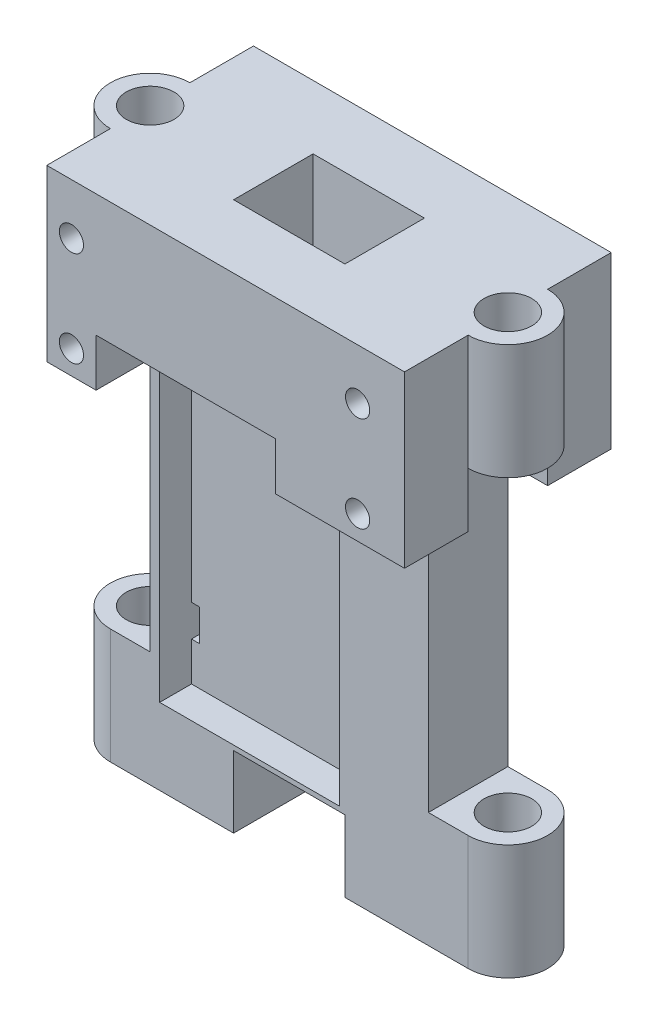
from build123d import *

# Parameters (mm, degrees)
SKETCH2_R                    = 3.81
BOSS_EXTRUDE1_DEPTH          = 43.815
SKETCH7_W                    = 28.702
SKETCH7_H                    = 55.88
CUT_EXTRUDE3_DEPTH           = 5.08
SKETCH11_W                   = 57.15
SKETCH11_H                   = 27.178
BOSS_EXTRUDE2_DEPTH          = 10.16
SKETCH14_W                   = 28.702
SKETCH14_H                   = 7.62
CUT_EXTRUDE4_DEPTH           = 10.16
SKETCH16_W                   = 17.78
SKETCH16_H                   = 12.7
CUT_EXTRUDE5_DEPTH           = 12.7
SKETCH17_W                   = 17.78
SKETCH17_H                   = 12.7
CUT_EXTRUDE6_DEPTH           = 11.43
CUT_EXTRUDE7_DEPTH           = 25.4
SKETCH21_W                   = 1.27
SKETCH21_H                   = 5.08
CUT_EXTRUDE8_DEPTH           = 59.784677
SKETCH23_R                   = 1.9304
CUT_EXTRUDE9_DEPTH           = 11.27
CUT_EXTRUDE9_DRAFT           = -8
CUT_EXTRUDE9_PROFILE_2_DEPTH = 11.27
CUT_EXTRUDE9_PROFILE_2_DRAFT = -8
CUT_EXTRUDE9_PROFILE_3_DEPTH = 11.27
CUT_EXTRUDE9_PROFILE_3_DRAFT = -8
CUT_EXTRUDE9_PROFILE_4_DEPTH = 11.27
CUT_EXTRUDE9_PROFILE_4_DRAFT = -8
MIRROR8_COPY_1_SKETCH_R      = 1.9304
MIRROR8_COPY_1_DEPTH         = 11.27
MIRROR8_COPY_1_DRAFT         = -8
MIRROR8_COPY_2_SKETCH_R      = 1.9304
MIRROR8_COPY_2_DEPTH         = 11.27
MIRROR8_COPY_2_DRAFT         = -8
MIRROR8_COPY_3_SKETCH_R      = 1.9304
MIRROR8_COPY_3_DEPTH         = 11.27
MIRROR8_COPY_3_DRAFT         = -8
MIRROR8_COPY_4_SKETCH_R      = 1.9304
MIRROR8_COPY_4_DEPTH         = 11.27
MIRROR8_COPY_4_DRAFT         = -8
MIRROR8_COPY_5_SKETCH_R      = 1.9304
MIRROR8_COPY_5_DEPTH         = 11.27
MIRROR8_COPY_5_DRAFT         = -8
MIRROR8_COPY_6_SKETCH_R      = 1.9304
MIRROR8_COPY_6_DEPTH         = 11.27
MIRROR8_COPY_6_DRAFT         = -8
MIRROR8_COPY_7_SKETCH_R      = 1.9304
MIRROR8_COPY_7_DEPTH         = 11.27
MIRROR8_COPY_7_DRAFT         = -8


with BuildPart() as part:
    # Sketch2 → Boss-Extrude1 (new, symmetric)
    with BuildSketch(Plane(origin=(0, 0, 0), x_dir=(1, 0, 0), z_dir=(0, 1, 0))):
        with BuildLine():
            Line((-28.575, 6.35), (28.575, 6.35))
            ThreePointArc((28.575, 6.35), (34.925, 0), (28.575, -6.35))
            Line((28.575, -6.35), (-28.575, -6.35))
            ThreePointArc((-28.575, -6.35), (-34.925, 0), (-28.575, 6.35))
        make_face()
        with Locations(Location((28.575, 0, 0), (0, 0, 270))):
            Circle(SKETCH2_R, mode=Mode.SUBTRACT)
        with Locations(Location((-28.575, 0, 0), (0, 0, 270))):
            Circle(SKETCH2_R, mode=Mode.SUBTRACT)
    extrude(amount=BOSS_EXTRUDE1_DEPTH, both=True)

    # Sketch7 → Cut-Extrude3 (cut)
    with BuildSketch(Plane.XY.offset(6.35)):
        with Locations((-6.35, -3.683)):
            Rectangle(SKETCH7_W, SKETCH7_H)
    cut_extrude3 = extrude(amount=-CUT_EXTRUDE3_DEPTH, mode=Mode.SUBTRACT)

    # Mirror1: Cut-Extrude3 across plane
    add(cut_extrude3.mirror(Plane.XY), mode=Mode.SUBTRACT)

    # Sketch11 → Boss-Extrude2 (add)
    with BuildSketch(Plane(origin=(0, 0, -6.35), x_dir=(-1, 0, 0), z_dir=(0, 0, -1))):
        with Locations((0, 30.226)):
            Rectangle(SKETCH11_W, SKETCH11_H)
    boss_extrude2 = extrude(amount=BOSS_EXTRUDE2_DEPTH)

    # Mirror3: Boss-Extrude2 across plane
    add(boss_extrude2.mirror(Plane.XY))

    # Sketch14 → Cut-Extrude4 (cut)
    with BuildSketch(Plane(origin=(0, 0, -16.51), x_dir=(-1, 0, 0), z_dir=(0, 0, -1))):
        with Locations((6.35, 20.447)):
            Rectangle(SKETCH14_W, SKETCH14_H)
    cut_extrude4 = extrude(amount=-CUT_EXTRUDE4_DEPTH, mode=Mode.SUBTRACT)

    # Mirror4: Cut-Extrude4 across plane
    add(cut_extrude4.mirror(Plane.XY), mode=Mode.SUBTRACT)

    # Sketch16 → Cut-Extrude5 (cut)
    with BuildSketch(Plane(origin=(0, 43.815, 0), x_dir=(1, 0, 0), z_dir=(0, 1, 0))):
        Rectangle(SKETCH16_W, SKETCH16_H)
    extrude(amount=-CUT_EXTRUDE5_DEPTH, mode=Mode.SUBTRACT)

    # Sketch17 → Cut-Extrude6 (cut)
    with BuildSketch(Plane.XZ.offset(43.815)):
        Rectangle(SKETCH17_W, SKETCH17_H)
    extrude(amount=-CUT_EXTRUDE6_DEPTH, mode=Mode.SUBTRACT)

    # Sketch19 → Cut-Extrude7 (cut, symmetric)
    with BuildSketch(Plane(origin=(0, 0, 0), x_dir=(1, 0, 0), z_dir=(0, 1, 0))):
        with BuildLine():
            Line((22.225, 6.35), (22.225, -6.35))
            Line((22.225, -6.35), (28.575, -6.35))
            ThreePointArc((28.575, -6.35), (34.925, 0), (28.575, 6.35))
            Line((28.575, 6.35), (22.225, 6.35))
        make_face()
    cut_extrude7 = extrude(amount=CUT_EXTRUDE7_DEPTH, both=True, mode=Mode.SUBTRACT)

    # Mirror5: Cut-Extrude7 across plane
    add(cut_extrude7.mirror(Plane(origin=(0, 0, 0), x_dir=(0, 0, 1), z_dir=(1, 0, 0))), mode=Mode.SUBTRACT)

    # Sketch21 → Cut-Extrude8 (cut, through all)
    with BuildSketch(Plane.XY.offset(1.27)):
        with Locations((7.366, 12.7)):
            Rectangle(SKETCH21_W, SKETCH21_H)
        with Locations((-20.066, 12.7)):
            Rectangle(SKETCH21_W, SKETCH21_H)
        with Locations((7.366, -22.86)):
            Rectangle(SKETCH21_W, SKETCH21_H)
        with Locations((-20.066, -22.86)):
            Rectangle(SKETCH21_W, SKETCH21_H)
    extrude(amount=-CUT_EXTRUDE8_DEPTH, mode=Mode.SUBTRACT)


with BuildPart() as cut_extrude9_tool:
    # Sketch23 → Cut-Extrude9 (with draft: the straight prism first)
    with BuildSketch(Plane.XY.offset(16.51)):
        with Locations((-24.638, 20.447)):
            Circle(SKETCH23_R)
    extrude(amount=-CUT_EXTRUDE9_DEPTH)
    # Cut-Extrude9: the draft: its side faces are tilted about the plane it starts from
    cut_extrude9_sides = [cut_extrude9_tool.faces().sort_by_distance(p)[0] for p in [
        (-26.5684, 20.447, 10.875),
    ]]
    draft(cut_extrude9_sides, Plane.XY.offset(16.51), CUT_EXTRUDE9_DRAFT)


with BuildPart() as part_1:
    add(part.part)

    # Cut-Extrude9: cut by cut_extrude9_tool
    add(cut_extrude9_tool.part, mode=Mode.SUBTRACT)


with BuildPart() as cut_extrude9_profile_2_tool:
    # Sketch23 → Cut-Extrude9 profile 2 (with draft: the straight prism first)
    with BuildSketch(Plane.XY.offset(16.51)):
        with Locations((-24.638, 35.687)):
            Circle(SKETCH23_R)
    extrude(amount=-CUT_EXTRUDE9_PROFILE_2_DEPTH)
    # Cut-Extrude9 profile 2: the draft: its side faces are tilted about the plane it starts from
    cut_extrude9_profile_2_sides = [cut_extrude9_profile_2_tool.faces().sort_by_distance(p)[0] for p in [
        (-26.5684, 35.687, 10.875),
    ]]
    draft(cut_extrude9_profile_2_sides, Plane.XY.offset(16.51), CUT_EXTRUDE9_PROFILE_2_DRAFT)


with BuildPart() as part_2:
    add(part_1.part)

    # Cut-Extrude9 profile 2: cut by cut_extrude9_profile_2_tool
    add(cut_extrude9_profile_2_tool.part, mode=Mode.SUBTRACT)


with BuildPart() as cut_extrude9_profile_3_tool:
    # Sketch23 → Cut-Extrude9 profile 3 (with draft: the straight prism first)
    with BuildSketch(Plane.XY.offset(16.51)):
        with Locations((21.082, 20.447)):
            Circle(SKETCH23_R)
    extrude(amount=-CUT_EXTRUDE9_PROFILE_3_DEPTH)
    # Cut-Extrude9 profile 3: the draft: its side faces are tilted about the plane it starts from
    cut_extrude9_profile_3_sides = [cut_extrude9_profile_3_tool.faces().sort_by_distance(p)[0] for p in [
        (19.1516, 20.447, 10.875),
    ]]
    draft(cut_extrude9_profile_3_sides, Plane.XY.offset(16.51), CUT_EXTRUDE9_PROFILE_3_DRAFT)


with BuildPart() as part_3:
    add(part_2.part)

    # Cut-Extrude9 profile 3: cut by cut_extrude9_profile_3_tool
    add(cut_extrude9_profile_3_tool.part, mode=Mode.SUBTRACT)


with BuildPart() as cut_extrude9_profile_4_tool:
    # Sketch23 → Cut-Extrude9 profile 4 (with draft: the straight prism first)
    with BuildSketch(Plane.XY.offset(16.51)):
        with Locations((21.082, 35.687)):
            Circle(SKETCH23_R)
    extrude(amount=-CUT_EXTRUDE9_PROFILE_4_DEPTH)
    # Cut-Extrude9 profile 4: the draft: its side faces are tilted about the plane it starts from
    cut_extrude9_profile_4_sides = [cut_extrude9_profile_4_tool.faces().sort_by_distance(p)[0] for p in [
        (19.1516, 35.687, 10.875),
    ]]
    draft(cut_extrude9_profile_4_sides, Plane.XY.offset(16.51), CUT_EXTRUDE9_PROFILE_4_DRAFT)


with BuildPart() as part_4:
    add(part_3.part)

    # Cut-Extrude9 profile 4: cut by cut_extrude9_profile_4_tool
    add(cut_extrude9_profile_4_tool.part, mode=Mode.SUBTRACT)


with BuildPart() as mirror8_copy_1_tool:
    # Mirror8 copy 1 sketch → Mirror8 copy 1 (with draft: the straight prism first)
    with BuildSketch(Plane(origin=(0, 0, -16.51), x_dir=(1, 0, 0), z_dir=(0, 0, -1))):
        with Locations((-24.638, -20.447)):
            Circle(MIRROR8_COPY_1_SKETCH_R)
    extrude(amount=-MIRROR8_COPY_1_DEPTH)
    # Mirror8 copy 1: the draft: its side faces are tilted about the plane it starts from
    mirror8_copy_1_sides = [mirror8_copy_1_tool.faces().sort_by_distance(p)[0] for p in [
        (-26.5684, 20.447, -10.875),
    ]]
    draft(mirror8_copy_1_sides, Plane(origin=(0, 0, -16.51), x_dir=(1, 0, 0), z_dir=(0, 0, -1)), MIRROR8_COPY_1_DRAFT)


with BuildPart() as part_5:
    add(part_4.part)

    # Mirror8 copy 1: cut by mirror8_copy_1_tool
    add(mirror8_copy_1_tool.part, mode=Mode.SUBTRACT)


with BuildPart() as mirror8_copy_2_tool:
    # Mirror8 copy 2 sketch → Mirror8 copy 2 (with draft: the straight prism first)
    with BuildSketch(Plane(origin=(0, 0, -16.51), x_dir=(1, 0, 0), z_dir=(0, 0, -1))):
        with Locations((-24.638, -35.687)):
            Circle(MIRROR8_COPY_2_SKETCH_R)
    extrude(amount=-MIRROR8_COPY_2_DEPTH)
    # Mirror8 copy 2: the draft: its side faces are tilted about the plane it starts from
    mirror8_copy_2_sides = [mirror8_copy_2_tool.faces().sort_by_distance(p)[0] for p in [
        (-26.5684, 35.687, -10.875),
    ]]
    draft(mirror8_copy_2_sides, Plane(origin=(0, 0, -16.51), x_dir=(1, 0, 0), z_dir=(0, 0, -1)), MIRROR8_COPY_2_DRAFT)


with BuildPart() as part_6:
    add(part_5.part)

    # Mirror8 copy 2: cut by mirror8_copy_2_tool
    add(mirror8_copy_2_tool.part, mode=Mode.SUBTRACT)


with BuildPart() as mirror8_copy_3_tool:
    # Mirror8 copy 3 sketch → Mirror8 copy 3 (with draft: the straight prism first)
    with BuildSketch(Plane(origin=(0, 0, -16.51), x_dir=(1, 0, 0), z_dir=(0, 0, -1))):
        with Locations((21.082, -20.447)):
            Circle(MIRROR8_COPY_3_SKETCH_R)
    extrude(amount=-MIRROR8_COPY_3_DEPTH)
    # Mirror8 copy 3: the draft: its side faces are tilted about the plane it starts from
    mirror8_copy_3_sides = [mirror8_copy_3_tool.faces().sort_by_distance(p)[0] for p in [
        (19.1516, 20.447, -10.875),
    ]]
    draft(mirror8_copy_3_sides, Plane(origin=(0, 0, -16.51), x_dir=(1, 0, 0), z_dir=(0, 0, -1)), MIRROR8_COPY_3_DRAFT)


with BuildPart() as part_7:
    add(part_6.part)

    # Mirror8 copy 3: cut by mirror8_copy_3_tool
    add(mirror8_copy_3_tool.part, mode=Mode.SUBTRACT)


with BuildPart() as mirror8_copy_4_tool:
    # Mirror8 copy 4 sketch → Mirror8 copy 4 (with draft: the straight prism first)
    with BuildSketch(Plane(origin=(0, 0, -16.51), x_dir=(1, 0, 0), z_dir=(0, 0, -1))):
        with Locations((21.082, -35.687)):
            Circle(MIRROR8_COPY_4_SKETCH_R)
    extrude(amount=-MIRROR8_COPY_4_DEPTH)
    # Mirror8 copy 4: the draft: its side faces are tilted about the plane it starts from
    mirror8_copy_4_sides = [mirror8_copy_4_tool.faces().sort_by_distance(p)[0] for p in [
        (19.1516, 35.687, -10.875),
    ]]
    draft(mirror8_copy_4_sides, Plane(origin=(0, 0, -16.51), x_dir=(1, 0, 0), z_dir=(0, 0, -1)), MIRROR8_COPY_4_DRAFT)


with BuildPart() as part_8:
    add(part_7.part)

    # Mirror8 copy 4: cut by mirror8_copy_4_tool
    add(mirror8_copy_4_tool.part, mode=Mode.SUBTRACT)


with BuildPart() as mirror8_copy_5_tool:
    # Mirror8 copy 5 sketch → Mirror8 copy 5 (with draft: the straight prism first)
    with BuildSketch(Plane(origin=(0, 0, -16.51), x_dir=(1, 0, 0), z_dir=(0, 0, -1))):
        with Locations((-24.638, -35.687)):
            Circle(MIRROR8_COPY_5_SKETCH_R)
    extrude(amount=-MIRROR8_COPY_5_DEPTH)
    # Mirror8 copy 5: the draft: its side faces are tilted about the plane it starts from
    mirror8_copy_5_sides = [mirror8_copy_5_tool.faces().sort_by_distance(p)[0] for p in [
        (-26.5684, 35.687, -10.875),
    ]]
    draft(mirror8_copy_5_sides, Plane(origin=(0, 0, -16.51), x_dir=(1, 0, 0), z_dir=(0, 0, -1)), MIRROR8_COPY_5_DRAFT)


with BuildPart() as part_9:
    add(part_8.part)

    # Mirror8 copy 5: cut by mirror8_copy_5_tool
    add(mirror8_copy_5_tool.part, mode=Mode.SUBTRACT)


with BuildPart() as mirror8_copy_6_tool:
    # Mirror8 copy 6 sketch → Mirror8 copy 6 (with draft: the straight prism first)
    with BuildSketch(Plane(origin=(0, 0, -16.51), x_dir=(1, 0, 0), z_dir=(0, 0, -1))):
        with Locations((21.082, -20.447)):
            Circle(MIRROR8_COPY_6_SKETCH_R)
    extrude(amount=-MIRROR8_COPY_6_DEPTH)
    # Mirror8 copy 6: the draft: its side faces are tilted about the plane it starts from
    mirror8_copy_6_sides = [mirror8_copy_6_tool.faces().sort_by_distance(p)[0] for p in [
        (19.1516, 20.447, -10.875),
    ]]
    draft(mirror8_copy_6_sides, Plane(origin=(0, 0, -16.51), x_dir=(1, 0, 0), z_dir=(0, 0, -1)), MIRROR8_COPY_6_DRAFT)


with BuildPart() as part_10:
    add(part_9.part)

    # Mirror8 copy 6: cut by mirror8_copy_6_tool
    add(mirror8_copy_6_tool.part, mode=Mode.SUBTRACT)


with BuildPart() as mirror8_copy_7_tool:
    # Mirror8 copy 7 sketch → Mirror8 copy 7 (with draft: the straight prism first)
    with BuildSketch(Plane(origin=(0, 0, -16.51), x_dir=(1, 0, 0), z_dir=(0, 0, -1))):
        with Locations((21.082, -35.687)):
            Circle(MIRROR8_COPY_7_SKETCH_R)
    extrude(amount=-MIRROR8_COPY_7_DEPTH)
    # Mirror8 copy 7: the draft: its side faces are tilted about the plane it starts from
    mirror8_copy_7_sides = [mirror8_copy_7_tool.faces().sort_by_distance(p)[0] for p in [
        (19.1516, 35.687, -10.875),
    ]]
    draft(mirror8_copy_7_sides, Plane(origin=(0, 0, -16.51), x_dir=(1, 0, 0), z_dir=(0, 0, -1)), MIRROR8_COPY_7_DRAFT)


with BuildPart() as part_11:
    add(part_10.part)

    # Mirror8 copy 7: cut by mirror8_copy_7_tool
    add(mirror8_copy_7_tool.part, mode=Mode.SUBTRACT)


solid = part_11.part
